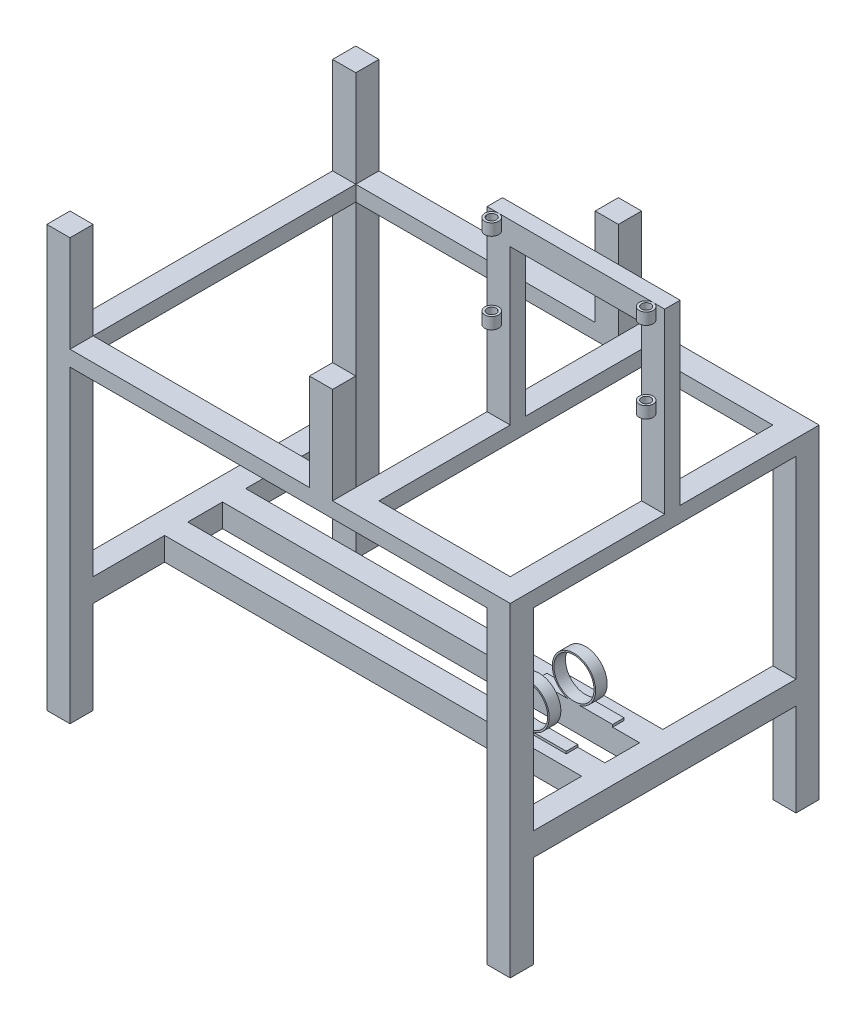
from build123d import *

# Parameters (mm, degrees)
SKETCH4_W              = 600
SKETCH4_H              = 400
SKETCH4_W_2            = 540
SKETCH4_H_2            = 340
BOSS_EXTRUDE2_DEPTH    = 20
SKETCH10_W             = 30
SKETCH10_H             = 20
BOSS_EXTRUDE7_DEPTH    = 370
SKETCH11_W             = 30
SKETCH11_H             = 20
BOSS_EXTRUDE8_DEPTH    = 230
SKETCH12_W             = 20
SKETCH12_H             = 30
BOSS_EXTRUDE9_DEPTH    = 170
SKETCH13_R             = 9
SKETCH13_R_2           = 6
BOSS_EXTRUDE10_DEPTH   = 15
BOSS_EXTRUDE10_2_DEPTH = 15
SKETCH14_W             = 20
SKETCH14_H             = 30
BOSS_EXTRUDE11_DEPTH   = 170
SKETCH15_R             = 9
SKETCH15_R_2           = 6
BOSS_EXTRUDE12_DEPTH   = 15
BOSS_EXTRUDE12_2_DEPTH = 15
SKETCH16_W             = 170
SKETCH16_H             = 30
CUT_EXTRUDE1_DEPTH     = 20
SKETCH17_W             = 30
SKETCH17_H             = 30
BOSS_EXTRUDE13_DEPTH   = 500
SKETCH18_W             = 30
SKETCH18_H             = 30
BOSS_EXTRUDE14_DEPTH   = 370
SKETCH19_W             = 30
SKETCH19_H             = 30
BOSS_EXTRUDE15_DEPTH   = 570
SKETCH21_R             = 26
BOSS_EXTRUDE17_DEPTH   = 15
BOSS_EXTRUDE18_START   = -15
SKETCH22_R             = 26
BOSS_EXTRUDE18_DEPTH   = 15
SKETCH23_W             = 30
SKETCH23_H             = 30
CUT_EXTRUDE2_DEPTH     = 100
SKETCH24_W             = 30
SKETCH24_H             = 30
BOSS_EXTRUDE19_DEPTH   = 125


with BuildPart() as part:
    # Sketch4 → Boss-Extrude2 (new body)
    with BuildSketch(Plane(origin=(0, 0, 0), x_dir=(1, 0, 0), z_dir=(0, 1, 0))):
        Rectangle(SKETCH4_W, SKETCH4_H)
        Rectangle(SKETCH4_W_2, SKETCH4_H_2, mode=Mode.SUBTRACT)
    extrude(amount=BOSS_EXTRUDE2_DEPTH)

    # Sketch10 → Boss-Extrude7 (add)
    with BuildSketch(Plane.XY.offset(200)):
        with Locations((85, 10)):
            Rectangle(SKETCH10_W, SKETCH10_H)
    extrude(amount=-BOSS_EXTRUDE7_DEPTH)

    # Sketch11 → Boss-Extrude8 (add)
    with BuildSketch(Plane(origin=(0, 20, 0), x_dir=(1, 0, 0), z_dir=(0, 1, 0))):
        with Locations((85, 10)):
            Rectangle(SKETCH11_W, SKETCH11_H)
        with Locations((285, 10)):
            Rectangle(SKETCH11_W, SKETCH11_H)
    extrude(amount=BOSS_EXTRUDE8_DEPTH)

    # Sketch12 → Boss-Extrude9 (add)
    with BuildSketch(Plane(origin=(100, 0, 0), x_dir=(0, 0, -1), z_dir=(1, 0, 0))):
        with Locations((10, 235)):
            Rectangle(SKETCH12_W, SKETCH12_H)
    extrude(amount=BOSS_EXTRUDE9_DEPTH)

    # Sketch14 → Boss-Extrude11 (add)
    with BuildSketch(Plane(origin=(100, 0, 0), x_dir=(0, 0, -1), z_dir=(1, 0, 0))):
        with Locations((10, 145)):
            Rectangle(SKETCH14_W, SKETCH14_H)
    extrude(amount=BOSS_EXTRUDE11_DEPTH)

    # Sketch16 → Cut-Extrude1 (cut)
    with BuildSketch(Plane(origin=(0, 0, -20), x_dir=(-1, 0, 0), z_dir=(0, 0, -1))):
        with Locations((-185, 145)):
            Rectangle(SKETCH16_W, SKETCH16_H)
    extrude(amount=-CUT_EXTRUDE1_DEPTH, mode=Mode.SUBTRACT)

    # Sketch17 → Boss-Extrude13 (add)
    with BuildSketch(Plane.XZ):
        with Locations((-285, 185)):
            Rectangle(SKETCH17_W, SKETCH17_H)
        with Locations((285, 185)):
            Rectangle(SKETCH17_W, SKETCH17_H)
        with Locations((285, -185)):
            Rectangle(SKETCH17_W, SKETCH17_H)
        with Locations((-285, -185)):
            Rectangle(SKETCH17_W, SKETCH17_H)
    extrude(amount=BOSS_EXTRUDE13_DEPTH)

    # Sketch18 → Boss-Extrude14 (add)
    with BuildSketch(Plane.XY.offset(200)):
        with Locations((285, -265)):
            Rectangle(SKETCH18_W, SKETCH18_H)
        with Locations((-285, -265)):
            Rectangle(SKETCH18_W, SKETCH18_H)
    extrude(amount=-BOSS_EXTRUDE14_DEPTH)

    # Sketch19 → Boss-Extrude15 (add)
    with BuildSketch(Plane.ZY.offset(300)):
        with Locations((-12.5, -265)):
            Rectangle(SKETCH19_W, SKETCH19_H)
        with Locations((62.5, -265)):
            Rectangle(SKETCH19_W, SKETCH19_H)
    extrude(amount=-BOSS_EXTRUDE15_DEPTH)

    # Sketch21 → Boss-Extrude17 (add)
    with BuildSketch(Plane.XY.offset(2.5)):
        with BuildLine():
            Line((192.416198487, -247), (235, -247))
            Line((235, -247), (235, -253))
            Line((235, -253), (135, -253))
            Line((135, -253), (135, -247))
            Line((135, -247), (177.583801513, -247))
            ThreePointArc((177.583801513, -247), (185, -192), (192.416198487, -247))
        make_face()
        with Locations((185, -220)):
            Circle(SKETCH21_R, mode=Mode.SUBTRACT)
    extrude(amount=-BOSS_EXTRUDE17_DEPTH)

    # Sketch22 → Boss-Extrude18 (add)
    with BuildSketch(Plane(origin=(0, 0, 47.5), x_dir=(-1, 0, 0), z_dir=(0, 0, -1)).offset(BOSS_EXTRUDE18_START)):
        with BuildLine():
            Line((-177.583801513, -247), (-135, -247))
            Line((-135, -247), (-135, -250))
            Line((-135, -250), (-235, -250))
            Line((-235, -250), (-235, -247))
            Line((-235, -247), (-192.416198487, -247))
            ThreePointArc((-192.416198487, -247), (-185, -192), (-177.583801513, -247))
        make_face()
        with Locations(Location((-185, -220, 0), (0, 0, 180))):
            Circle(SKETCH22_R, mode=Mode.SUBTRACT)
    extrude(amount=BOSS_EXTRUDE18_DEPTH)

    # Sketch23 → Cut-Extrude2 (cut)
    with BuildSketch(Plane.XZ.offset(500)):
        with Locations((-285, 185)):
            Rectangle(SKETCH23_W, SKETCH23_H)
        with Locations((285, 185)):
            Rectangle(SKETCH23_W, SKETCH23_H)
        with Locations((285, -185)):
            Rectangle(SKETCH23_W, SKETCH23_H)
        with Locations((-285, -185)):
            Rectangle(SKETCH23_W, SKETCH23_H)
    extrude(amount=-CUT_EXTRUDE2_DEPTH, mode=Mode.SUBTRACT)

    # Sketch24 → Boss-Extrude19 (add)
    with BuildSketch(Plane(origin=(0, 20, 0), x_dir=(1, 0, 0), z_dir=(0, 1, 0))):
        with Locations((-285, 185)):
            Rectangle(SKETCH24_W, SKETCH24_H)
        with Locations((55, 185)):
            Rectangle(SKETCH24_W, SKETCH24_H)
        with Locations((55, -185)):
            Rectangle(SKETCH24_W, SKETCH24_H)
        with Locations((-285, -185)):
            Rectangle(SKETCH24_W, SKETCH24_H)
    extrude(amount=BOSS_EXTRUDE19_DEPTH)


with BuildPart() as body_2:
    # Sketch13 → Boss-Extrude10 (new body)
    with BuildSketch(Plane(origin=(0, 250, 0), x_dir=(1, 0, 0), z_dir=(0, 1, 0))):
        with Locations(Location((85, -9, 0), (0, 0, 270))):
            Circle(SKETCH13_R)
        with Locations(Location((85, -9, 0), (0, 0, 270))):
            Circle(SKETCH13_R_2, mode=Mode.SUBTRACT)
    extrude(amount=-BOSS_EXTRUDE10_DEPTH)


with BuildPart() as body_3:
    # Sketch13 → Boss-Extrude10 2 (new body)
    with BuildSketch(Plane(origin=(0, 250, 0), x_dir=(1, 0, 0), z_dir=(0, 1, 0))):
        with Locations(Location((285, -9, 0), (0, 0, 270))):
            Circle(SKETCH13_R)
        with Locations(Location((285, -9, 0), (0, 0, 270))):
            Circle(SKETCH13_R_2, mode=Mode.SUBTRACT)
    extrude(amount=-BOSS_EXTRUDE10_2_DEPTH)


with BuildPart() as body_4:
    # Sketch15 → Boss-Extrude12 (new body)
    with BuildSketch(Plane.XZ.offset(-130)):
        with Locations(Location((85, 9, 0), (0, 0, 270))):
            Circle(SKETCH15_R)
        with Locations(Location((85, 9, 0), (0, 0, 270))):
            Circle(SKETCH15_R_2, mode=Mode.SUBTRACT)
    extrude(amount=-BOSS_EXTRUDE12_DEPTH)


with BuildPart() as body_5:
    # Sketch15 → Boss-Extrude12 2 (new body)
    with BuildSketch(Plane.XZ.offset(-130)):
        with Locations(Location((285, 9, 0), (0, 0, 270))):
            Circle(SKETCH15_R)
        with Locations(Location((285, 9, 0), (0, 0, 270))):
            Circle(SKETCH15_R_2, mode=Mode.SUBTRACT)
    extrude(amount=-BOSS_EXTRUDE12_2_DEPTH)


solid = Compound([part.part, body_2.part, body_3.part, body_4.part, body_5.part])
